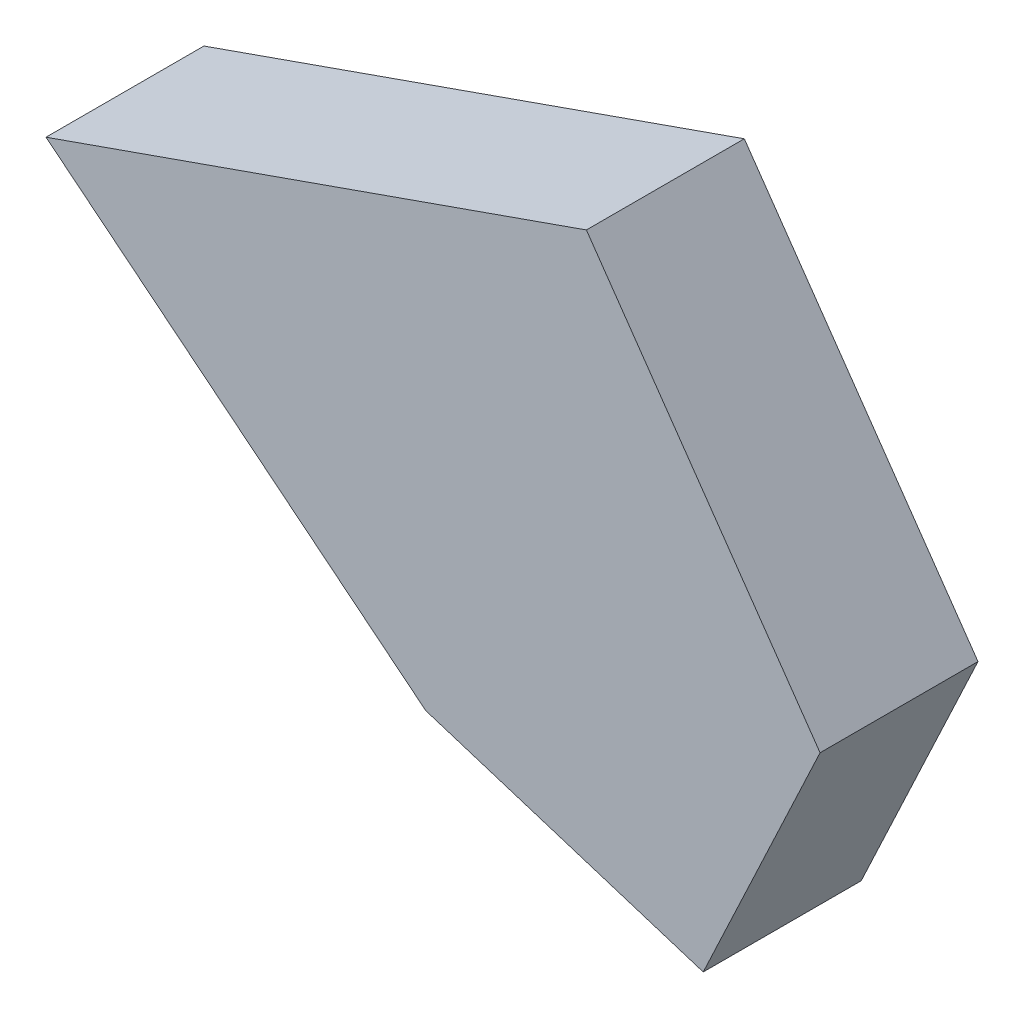
from build123d import *

# Parameters (mm, degrees)
BOSS_EXTRUDE1_DEPTH = 10.813


with BuildPart() as part:
    # Sketch1 → Boss-Extrude1 (new body)
    with BuildSketch(Plane.XY):
        Polygon((0, -3), (19, -9), (27, 8), (11, 31), (-26, 18), align=None)
    extrude(amount=BOSS_EXTRUDE1_DEPTH)


solid = part.part
